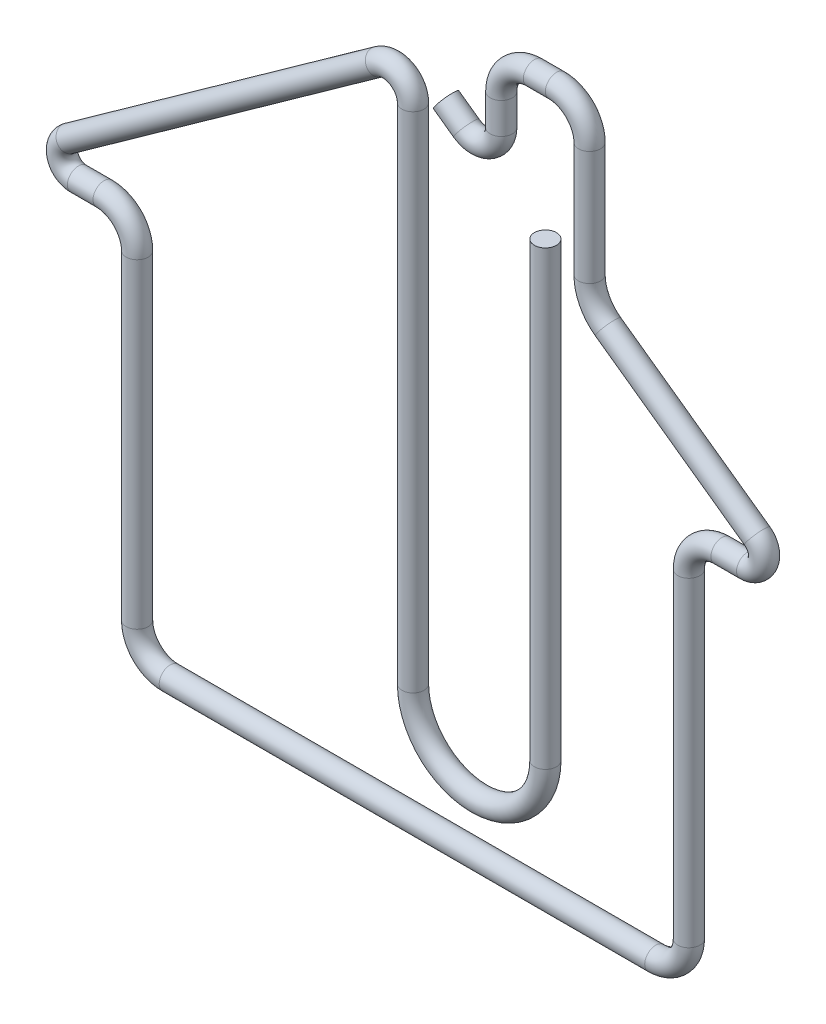
from build123d import *

# Parameters (mm, degrees)
SKETCH_3_R = 1


with BuildPart() as part:
    # По траектории2: sweep along a path in Эскиз2
    with BuildLine(Plane.XY) as sweep_2_path:
        Line((3, 40.357142857), (4.837523613, 39.044625991))
        ThreePointArc((4.837523613, 39.044625991), (6.915163162, 38.893757648), (8, 40.672092933))
        Line((8, 40.672092933), (8, 43.5))
        ThreePointArc((8, 43.5), (8.878679656, 45.621320344), (11, 46.5))
        Line((11, 46.5), (13, 46.5))
        ThreePointArc((13, 46.5), (15.121320344, 45.621320344), (16, 43.5))
        Line((16, 43.5), (16, 33.129900153))
        ThreePointArc((16, 33.129900153), (16.443329429, 31.299573829), (17.675047225, 29.874966268))
        Line((17.675047225, 29.874966268), (31.19115971, 20.220600207))
        ThreePointArc((31.19115971, 20.220600207), (31.747745683, 18.542233853), (30.31930242, 17.5))
        Line((30.31930242, 17.5), (28, 17.5))
        ThreePointArc((28, 17.5), (25.878679656, 16.621320344), (25, 14.5))
        Line((25, 14.5), (25, -14.5))
        ThreePointArc((25, -14.5), (24.121320344, -16.621320344), (22, -17.5))
        Line((22, -17.5), (-22, -17.5))
        ThreePointArc((-22, -17.5), (-24.121320344, -16.621320344), (-25, -14.5))
        Line((-25, -14.5), (-25, 14.5))
        ThreePointArc((-25, 14.5), (-25.878679656, 16.621320344), (-28, 17.5))
        Line((-28, 17.5), (-30.31930242, 17.5))
        ThreePointArc((-30.31930242, 17.5), (-31.747745683, 18.542233853), (-31.19115971, 20.220600207))
        Line((-31.19115971, 20.220600207), (-3.162476387, 40.241088295))
        ThreePointArc((-3.162476387, 40.241088295), (-1.084836838, 40.391956638), (0, 38.613621352))
        Line((0, 38.613621352), (0, -7))
        ThreePointArc((0, -7), (6, -13), (12, -7))
        Line((12, -7), (12, 33.928571429))
    # Эскиз3 → По траектории2 (sweep)
    with BuildSketch(Plane(origin=(12, 33.928571429, 0), x_dir=(-1, 0, 0), z_dir=(0, -1, 0))):
        Circle(SKETCH_3_R)
    sweep(path=sweep_2_path.line)


solid = part.part
